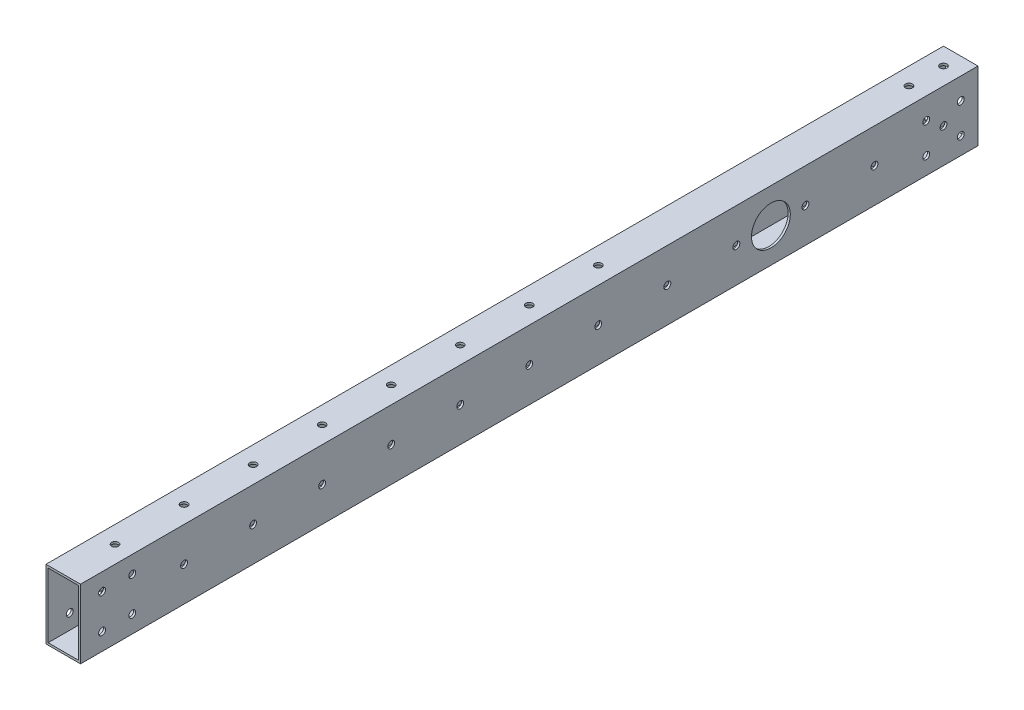
from build123d import *

# Parameters (mm, degrees)
SKETCH1_W           = 25.4
SKETCH1_H           = 50.8
SKETCH1_W_2         = 22.225
SKETCH1_H_2         = 47.625
BOSS_EXTRUDE1_DEPTH = 660.4
SKETCH2_R           = 2.54
SKETCH2_R_2         = 14.2875
CUT_EXTRUDE1_DEPTH  = 662.376201568
SKETCH3_R           = 2.54
CUT_EXTRUDE3_DEPTH  = 663.472708872


with BuildPart() as part:
    # Sketch1 → Boss-Extrude1 (new body)
    with BuildSketch(Plane.XY):
        Rectangle(SKETCH1_W, SKETCH1_H)
        Rectangle(SKETCH1_W_2, SKETCH1_H_2, mode=Mode.SUBTRACT)
    extrude(amount=BOSS_EXTRUDE1_DEPTH)

    # Sketch2 → Cut-Extrude1 (cut, through all)
    with BuildSketch(Plane(origin=(12.7, 0, 0), x_dir=(0, 0, -1), z_dir=(1, 0, 0))):
        with Locations((-38.1, 9.525)):
            Circle(SKETCH2_R)
        with Locations((-38.1, -12.7)):
            Circle(SKETCH2_R)
        with Locations((-12.7, 9.525)):
            Circle(SKETCH2_R)
        with Locations((-12.7, -12.7)):
            Circle(SKETCH2_R)
        with Locations((-152.4, 0)):
            Circle(SKETCH2_R_2)
        with Locations((-644.525, -12.7)):
            Circle(SKETCH2_R)
        with Locations((-622.3, -12.7)):
            Circle(SKETCH2_R)
        with Locations((-644.525, 12.7)):
            Circle(SKETCH2_R)
        with Locations((-622.3, 12.7)):
            Circle(SKETCH2_R)
        with Locations((-25.4, 0)):
            Circle(SKETCH2_R)
        with Locations((-76.2, 0)):
            Circle(SKETCH2_R)
        with Locations((-127, 0)):
            Circle(SKETCH2_R)
        with Locations((-177.8, 0)):
            Circle(SKETCH2_R)
        with Locations((-228.6, 0)):
            Circle(SKETCH2_R)
        with Locations((-279.4, 0)):
            Circle(SKETCH2_R)
        with Locations((-330.2, 0)):
            Circle(SKETCH2_R)
        with Locations((-381, 0)):
            Circle(SKETCH2_R)
        with Locations((-431.8, 0)):
            Circle(SKETCH2_R)
        with Locations((-482.6, 0)):
            Circle(SKETCH2_R)
        with Locations((-533.4, 0)):
            Circle(SKETCH2_R)
        with Locations((-584.2, 0)):
            Circle(SKETCH2_R)
    extrude(amount=-CUT_EXTRUDE1_DEPTH, mode=Mode.SUBTRACT)

    # Sketch3 → Cut-Extrude3 (cut, through all)
    with BuildSketch(Plane(origin=(0, 25.4, 0), x_dir=(1, 0, 0), z_dir=(0, 1, 0))):
        with Locations(Location((0, -12.7, 0), (0, 0, 270))):
            Circle(SKETCH3_R)
        with Locations(Location((0, -38.1, 0), (0, 0, 270))):
            Circle(SKETCH3_R)
        with Locations(Location((0, -622.3, 0), (0, 0, 270))):
            Circle(SKETCH3_R)
        with Locations(Location((0, -571.5, 0), (0, 0, 270))):
            Circle(SKETCH3_R)
        with Locations(Location((0, -520.7, 0), (0, 0, 270))):
            Circle(SKETCH3_R)
        with Locations(Location((0, -469.9, 0), (0, 0, 270))):
            Circle(SKETCH3_R)
        with Locations(Location((0, -419.1, 0), (0, 0, 270))):
            Circle(SKETCH3_R)
        with Locations(Location((0, -368.3, 0), (0, 0, 270))):
            Circle(SKETCH3_R)
        with Locations(Location((0, -317.5, 0), (0, 0, 270))):
            Circle(SKETCH3_R)
        with Locations(Location((0, -266.7, 0), (0, 0, 270))):
            Circle(SKETCH3_R)
    extrude(amount=-CUT_EXTRUDE3_DEPTH, mode=Mode.SUBTRACT)


solid = part.part
